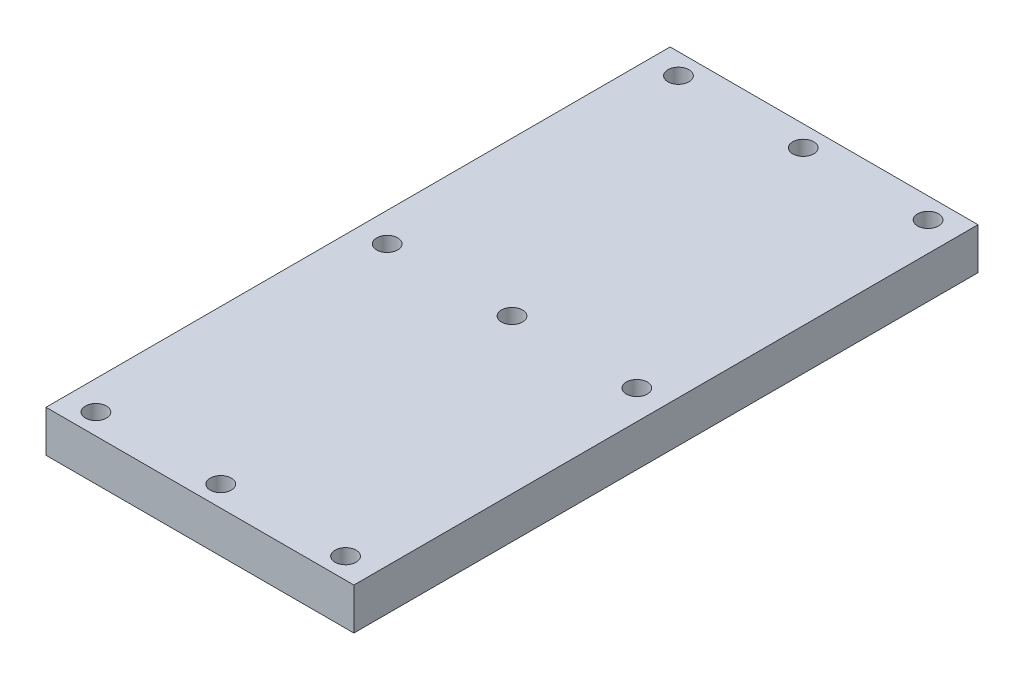
from build123d import *

# Parameters (mm, degrees)
ESBO_O1_W                = 37
ESBO_O1_H                = 75
ESBO_O1_R                = 1.265
RESSALTO_EXTRUS_O2_DEPTH = 5


with BuildPart() as part:
    # Esboço1 → Ressalto-extrusão2 (new body)
    with BuildSketch(Plane(origin=(0, 0, 0), x_dir=(1, 0, 0), z_dir=(0, 1, 0))):
        with Locations((18.5, 37.5)):
            Rectangle(ESBO_O1_W, ESBO_O1_H)
        with Locations(Location((3.5, 72.5, 0), (0, 0, 270))):
            Circle(ESBO_O1_R, mode=Mode.SUBTRACT)
        with Locations(Location((18.5, 72.5, 0), (0, 0, 270))):
            Circle(ESBO_O1_R, mode=Mode.SUBTRACT)
        with Locations(Location((33.5, 72.5, 0), (0, 0, 270))):
            Circle(ESBO_O1_R, mode=Mode.SUBTRACT)
        with Locations(Location((18.5, 37.5, 0), (0, 0, 270))):
            Circle(ESBO_O1_R, mode=Mode.SUBTRACT)
        with Locations(Location((33.5, 37.5, 0), (0, 0, 270))):
            Circle(ESBO_O1_R, mode=Mode.SUBTRACT)
        with Locations(Location((18.5, 2.5, 0), (0, 0, 270))):
            Circle(ESBO_O1_R, mode=Mode.SUBTRACT)
        with Locations(Location((33.5, 2.5, 0), (0, 0, 270))):
            Circle(ESBO_O1_R, mode=Mode.SUBTRACT)
        with Locations(Location((3.5, 37.5, 0), (0, 0, 270))):
            Circle(ESBO_O1_R, mode=Mode.SUBTRACT)
        with Locations(Location((3.5, 2.5, 0), (0, 0, 270))):
            Circle(ESBO_O1_R, mode=Mode.SUBTRACT)
    extrude(amount=RESSALTO_EXTRUS_O2_DEPTH)


solid = part.part
